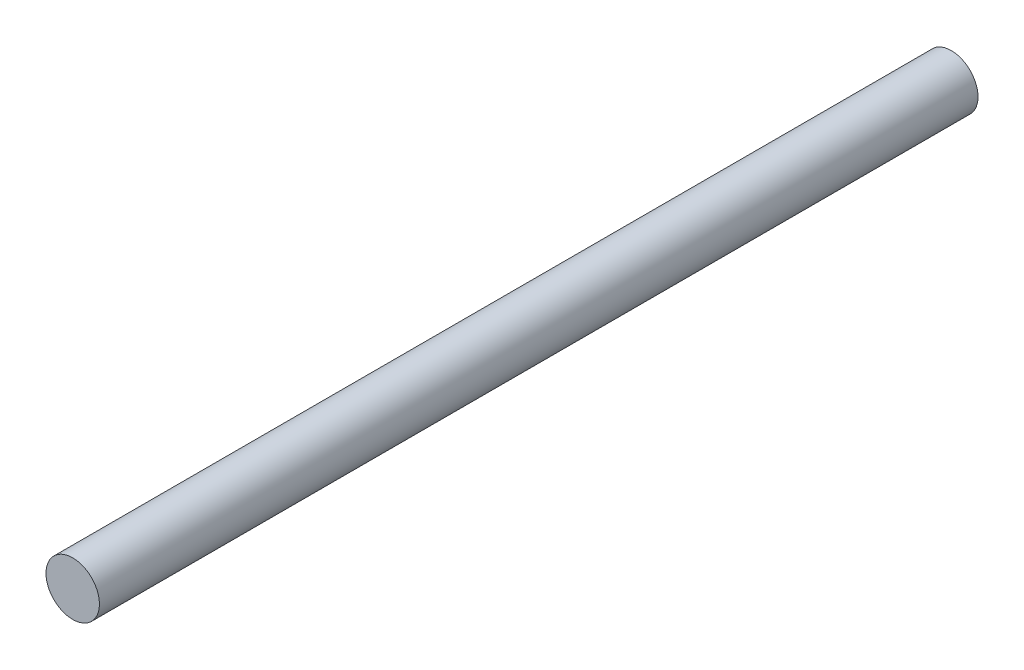
from build123d import *

# Parameters (mm, degrees)
SKETCH_7_R           = 35
SKETCH_7_R_2         = 15
EXTRUDE_1_DEPTH      = 15
EXTRUDE_2_REACH      = 817.889
EXTRUDE_2_END_RADIUS = 35
SKETCH_5_R           = 22.5
SKETCH_8_W           = 185.294970715
SKETCH_8_H           = 135.350234673
CUT_EXTRUDE_1_DEPTH  = 25


with BuildPart() as part:
    # 草图7 → 凸台-拉伸1 (new, symmetric)
    with BuildSketch(Plane(origin=(0, 0, 0), x_dir=(1, 0, 0), z_dir=(0, 1, 0))):
        with Locations(Location((0, -500, 0), (0, 0, 270))):
            Circle(SKETCH_7_R)
        with Locations(Location((0, -500, 0), (0, 0, 270))):
            Circle(SKETCH_7_R_2, mode=Mode.SUBTRACT)
    extrude(amount=EXTRUDE_1_DEPTH, both=True)

    # 凸台-拉伸2: up to this cylinder (the profile starts outside it)
    extrude_2_end = Plane(origin=(0, 0, 500), z_dir=(0, -1, 0)) * Cylinder(EXTRUDE_2_END_RADIUS, 1706.778, mode=Mode.PRIVATE)
    # 草图5 → 凸台-拉伸2 (add, up to the surface)
    with BuildSketch(Plane.XY.offset(-280), mode=Mode.PRIVATE) as extrude_2_sk1:
        with Locations(Location((0, 0, 0), (0, 0, 138.189685104))):
            Circle(SKETCH_5_R)
    extrude_2_tool1 = extrude(extrude_2_sk1.sketch, amount=EXTRUDE_2_REACH, mode=Mode.PRIVATE) - extrude_2_end
    add(extrude_2_tool1.solids().sort_by_distance((0, 0, -280))[0])

    # 草图8 → 切除-拉伸1 (cut, symmetric)
    with BuildSketch(Plane(origin=(0, 0, 0), x_dir=(1, 0, 0), z_dir=(0, 1, 0))):
        with Locations((-2.493067274, -527.675117337)):
            Rectangle(SKETCH_8_W, SKETCH_8_H)
    extrude(amount=CUT_EXTRUDE_1_DEPTH, both=True, mode=Mode.SUBTRACT)


solid = part.part
